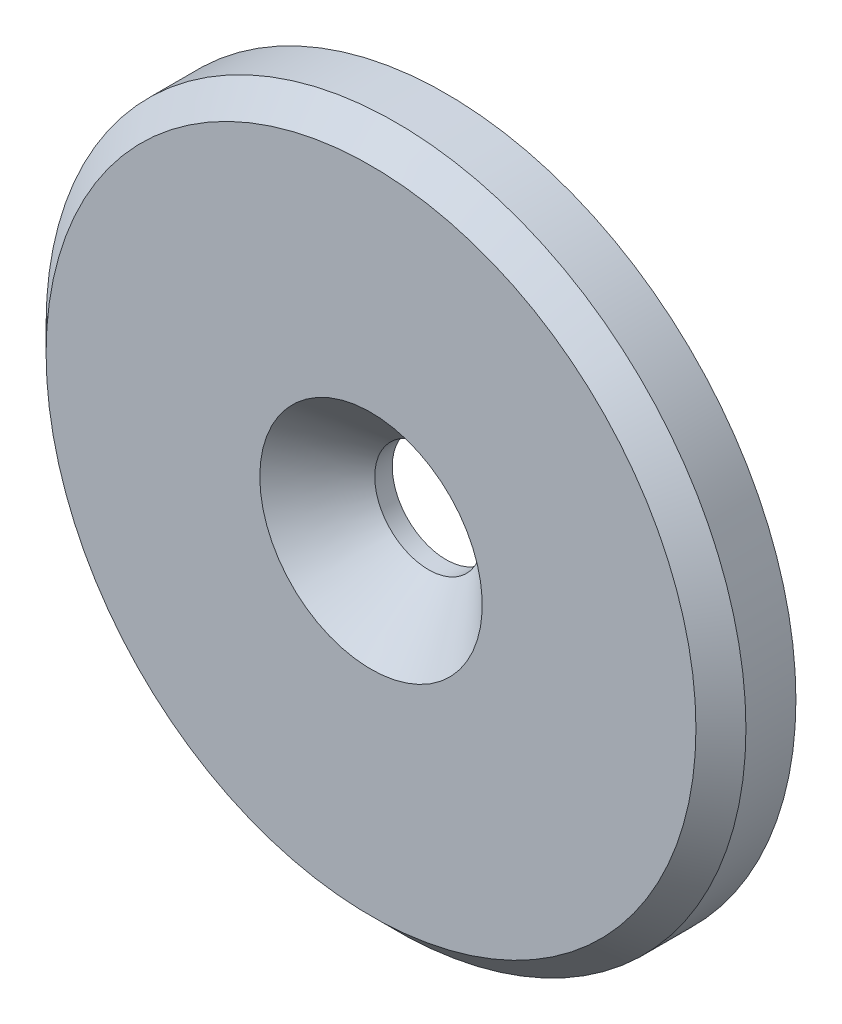
from build123d import *

# Parameters (mm, degrees)
SZKIC1_W                    = 14
SZKIC1_H                    = 3
SZKIC4_R                    = 10.5
DODANIE_WYCI_GNI_CIE1_DEPTH = 7


with BuildPart() as part:
    # Szkic1 → Obrót1 (revolve)
    with BuildSketch(Plane(origin=(0, 0, 0), x_dir=(1, 0, 0), z_dir=(0, 1, 0)), mode=Mode.PRIVATE) as obr_t1_sk:
        with Locations((7, -1.5)):
            Rectangle(SZKIC1_W, SZKIC1_H)
    revolve(obr_t1_sk.sketch.rotate(Axis((0, 0, 3), (0, 0, -1)), 180), axis=Axis((0, 0, 3), (0, 0, -1)))

    # Szkic2 → Wycięcie-obrót1 (revolve, cut)
    with BuildSketch(Plane(origin=(0, 0, 0), x_dir=(1, 0, 0), z_dir=(0, 1, 0)), mode=Mode.PRIVATE) as wyci_cie_obr_t1_sk:
        Polygon((13, -3), (14, -3), (14, -2), align=None)
    revolve(wyci_cie_obr_t1_sk.sketch.rotate(Axis((0, 0, 3), (0, 0, -1)), 180), axis=Axis((0, 0, 3), (0, 0, -1)), mode=Mode.SUBTRACT)

    # Szkic3 → Wycięcie-obrót2 (revolve, cut)
    with BuildSketch(Plane(origin=(0, 0, 0), x_dir=(1, 0, 0), z_dir=(0, 1, 0)), mode=Mode.PRIVATE) as wyci_cie_obr_t2_sk:
        Polygon((0, 0), (2.15, 0), (2.15, -0.7), (4.45, -3), (0, -3), align=None)
    revolve(wyci_cie_obr_t2_sk.sketch.rotate(Axis((0, 0, 3), (0, 0, -1)), 180), axis=Axis((0, 0, 3), (0, 0, -1)), mode=Mode.SUBTRACT)


with BuildPart() as body_2:
    # Szkic4 → Dodanie-wyciągnięcie1 (new body)
    with BuildSketch(Plane(origin=(0, 0, 0), x_dir=(0, 0, -1), z_dir=(1, 0, 0))):
        Circle(SZKIC4_R)
    extrude(amount=DODANIE_WYCI_GNI_CIE1_DEPTH)

    # Usuń ścianę1: 1 face struck out; the rest of the skin is kept as a surface, the solid goes
    usu_cian_1_1_drop = [body_2.part.faces().sort_by_distance(Vector(p))[0] for p in ((7, 0, 0),)]
    usu_cian_1_1 = Shell(body_2.part.faces() - usu_cian_1_1_drop)


solid = part.part
